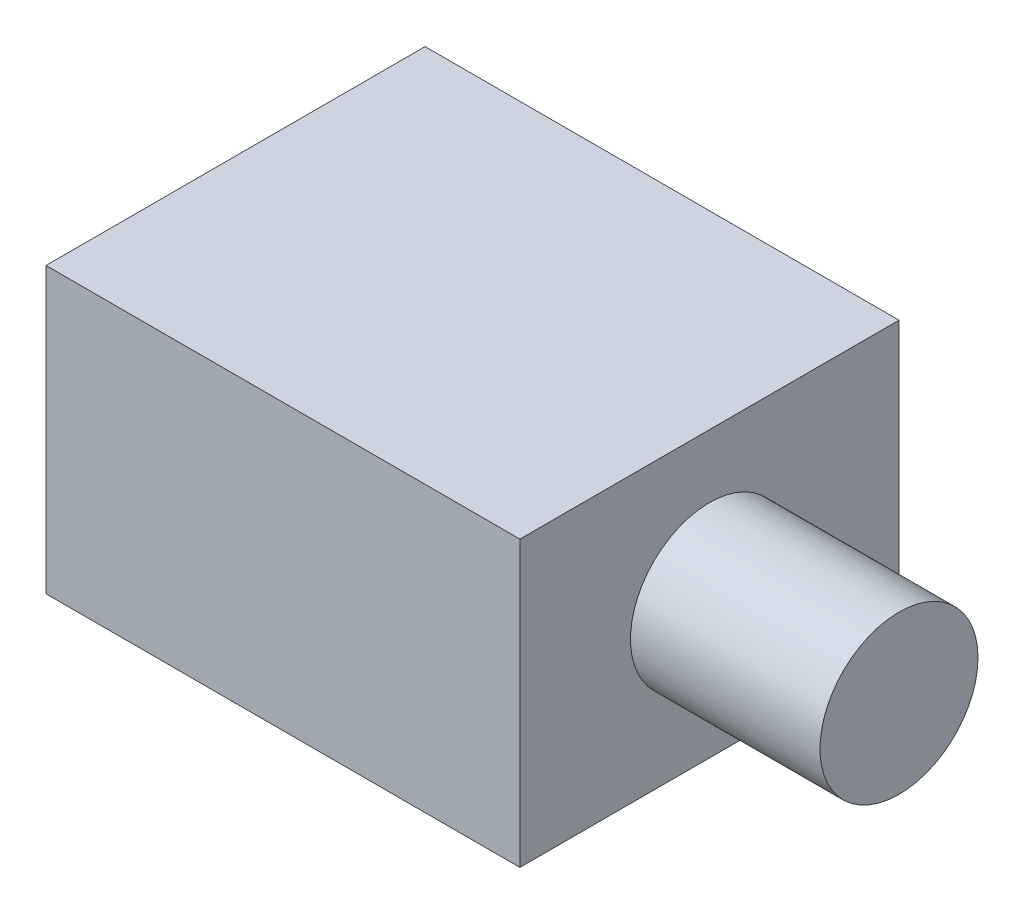
from build123d import *

# Parameters (mm, degrees)
SKETCH_1_W      = 60
SKETCH_1_H      = 48
EXTRUDE_1_DEPTH = 36
EXTRUDE_2_REACH = 96.488
SKETCH_2_R      = 10


with BuildPart() as part:
    # 草图1 → 凸台-拉伸1 (new body)
    with BuildSketch(Plane(origin=(0, 0, 0), x_dir=(1, 0, 0), z_dir=(0, 1, 0))):
        Rectangle(SKETCH_1_W, SKETCH_1_H)
    extrude(amount=EXTRUDE_1_DEPTH)

    # 草图2 → 凸台-拉伸2 (add, up to next)
    with BuildSketch(Plane(origin=(54, 0, 0), x_dir=(0, 0, -1), z_dir=(1, 0, 0)), mode=Mode.PRIVATE) as extrude_2_sk1:
        with Locations((0, 18)):
            Circle(SKETCH_2_R)
    extrude_2_tool1 = extrude(extrude_2_sk1.sketch, amount=-EXTRUDE_2_REACH, mode=Mode.PRIVATE) - part.part
    add(extrude_2_tool1.solids().sort_by_distance((54, 18, 0))[0])


solid = part.part
